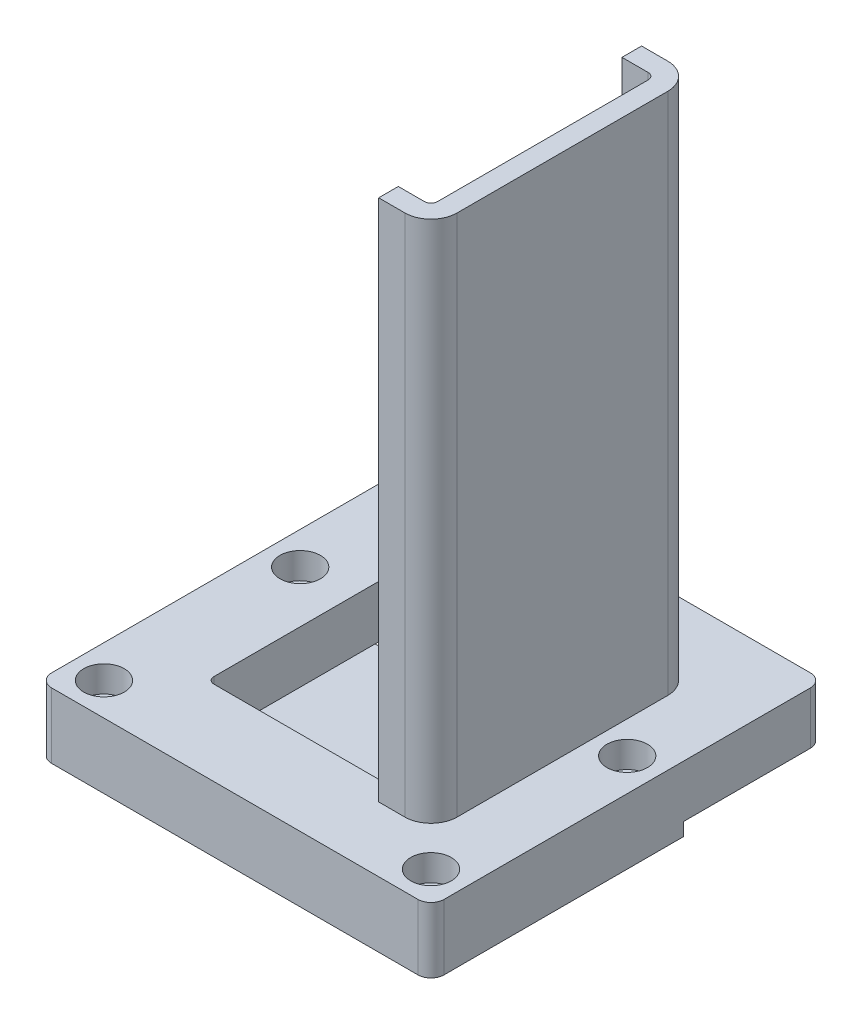
from build123d import *

# Parameters (mm, degrees)
SKETCH1_W           = 76.2
SKETCH1_H           = 76.2
BOSS_EXTRUDE1_DEPTH = 12.7
SKETCH2_W           = 43.434
SKETCH2_H           = 43.434
CUT_EXTRUDE1_DEPTH  = 10.16
FILLET1_R           = 1.27
CUT_EXTRUDE2_DEPTH  = 55.831064188
SKETCH4_R           = 2.54
CUT_EXTRUDE3_DEPTH  = 56.358016583
FILLET2_R           = 2.54
SKETCH5_W           = 76.2
SKETCH5_H           = 27.178
CUT_EXTRUDE4_DEPTH  = 2.54
BOSS_EXTRUDE2_DEPTH = 101.6
CUT_EXTRUDE6_DEPTH  = 1.27
SKETCH9_R           = 3.937
CUT_EXTRUDE7_DEPTH  = 5.08


with BuildPart() as part:
    # Sketch1 → Boss-Extrude1 (new body)
    with BuildSketch(Plane(origin=(0, 0, 0), x_dir=(1, 0, 0), z_dir=(0, 1, 0))):
        Rectangle(SKETCH1_W, SKETCH1_H)
    extrude(amount=BOSS_EXTRUDE1_DEPTH)

    # Sketch2 → Cut-Extrude1 (cut)
    with BuildSketch(Plane(origin=(0, 12.7, 0), x_dir=(1, 0, 0), z_dir=(0, 1, 0))):
        Rectangle(SKETCH2_W, SKETCH2_H)
    extrude(amount=-CUT_EXTRUDE1_DEPTH, mode=Mode.SUBTRACT)

    # Fillet1
    fillet1_edges = [part.edges().sort_by_distance(p)[0] for p in [
        (21.717, 7.62, -21.717),
        (21.717, 7.62, 21.717),
        (-21.717, 7.62, 21.717),
        (-21.717, 7.62, -21.717),
    ]]
    fillet(fillet1_edges, radius=FILLET1_R)

    # Sketch3 → Cut-Extrude2 (cut, through all)
    with BuildSketch(Plane(origin=(0, 2.54, 0), x_dir=(1, 0, 0), z_dir=(0, 1, 0))):
        with BuildLine():
            Line((-21.717, 10.8585), (21.717, 10.8585))
            Line((21.717, 10.8585), (21.717, 20.447))
            ThreePointArc((21.717, 20.447), (21.345025612, 21.345025612), (20.447, 21.717))
            Line((20.447, 21.717), (-20.447, 21.717))
            ThreePointArc((-20.447, 21.717), (-21.345025612, 21.345025612), (-21.717, 20.447))
            Line((-21.717, 20.447), (-21.717, 10.8585))
        make_face()
    extrude(amount=-CUT_EXTRUDE2_DEPTH, mode=Mode.SUBTRACT)

    # Sketch4 → Cut-Extrude3 (cut, through all)
    with BuildSketch(Plane(origin=(0, 12.7, 0), x_dir=(1, 0, 0), z_dir=(0, 1, 0))):
        with Locations(Location((31.75, -31.75, 0), (0, 0, 270))):
            Circle(SKETCH4_R)
        with Locations(Location((-31.75, -31.75, 0), (0, 0, 270))):
            Circle(SKETCH4_R)
        with Locations(Location((-31.75, 6.35, 0), (0, 0, 270))):
            Circle(SKETCH4_R)
        with Locations(Location((31.75, 6.35, 0), (0, 0, 270))):
            Circle(SKETCH4_R)
    extrude(amount=-CUT_EXTRUDE3_DEPTH, mode=Mode.SUBTRACT)

    # Fillet2
    fillet2_edges = [part.edges().sort_by_distance(p)[0] for p in [
        (38.1, 6.35, 38.1),
        (-38.1, 6.35, 38.1),
        (-38.1, 6.35, -38.1),
        (38.1, 6.35, -38.1),
    ]]
    fillet(fillet2_edges, radius=FILLET2_R)

    # Sketch5 → Cut-Extrude4 (cut)
    with BuildSketch(Plane.XZ):
        with Locations((0, -24.511)):
            Rectangle(SKETCH5_W, SKETCH5_H)
    extrude(amount=-CUT_EXTRUDE4_DEPTH, mode=Mode.SUBTRACT)

    # Sketch6 → Boss-Extrude2 (add)
    with BuildSketch(Plane(origin=(0, 12.7, 0), x_dir=(1, 0, 0), z_dir=(0, 1, 0))):
        with BuildLine():
            Line((21.717, 20.447), (21.717, -20.447))
            ThreePointArc((21.717, -20.447), (21.345025612, -21.345025612), (20.447, -21.717))
            Line((20.447, -21.717), (15.367, -21.717))
            Line((15.367, -21.717), (15.367, -25.527))
            Line((15.367, -25.527), (20.447, -25.527))
            ThreePointArc((20.447, -25.527), (24.039102448, -24.039102448), (25.527, -20.447))
            Line((25.527, -20.447), (25.527, 20.447))
            ThreePointArc((25.527, 20.447), (24.039102448, 24.039102448), (20.447, 25.527))
            Line((20.447, 25.527), (15.367, 25.527))
            Line((15.367, 25.527), (15.367, 21.717))
            Line((15.367, 21.717), (20.447, 21.717))
            ThreePointArc((20.447, 21.717), (21.345025612, 21.345025612), (21.717, 20.447))
        make_face()
    extrude(amount=BOSS_EXTRUDE2_DEPTH)

    # Sketch8 → Cut-Extrude6 (cut)
    # profile 1 of 6: a face of its own
    with BuildSketch(Plane.ZY.offset(38.1)):
        with BuildLine():
            Line((-4.12529872, 4.373330192), (-4.12529872, 9.664996859))
            Line((-4.12529872, 9.664996859), (-3.277275215, 9.664996859))
            add(Edge.make_bspline(
                [(-3.277275215, 9.664996859), (-3.217908268, 9.665003634), (-3.103034349, 9.665016744), (-2.937301264, 9.659196742), (-2.783597825, 9.651667918), (-2.642413174, 9.643244914), (-2.513507007, 9.628730396), (-2.397075345, 9.613433679), (-2.292885559, 9.594986781), (-2.228470675, 9.578439343), (-2.198165306, 9.570654244)],
                knots=[0, 0, 0, 0, 1.311965854, 2.538629056, 3.664479157, 4.713267157, 5.663616078, 6.530575999, 7.308677837, 8, 8, 8, 8], degree=3))
            add(Edge.make_bspline(
                [(-2.198165306, 9.570654244), (-2.15837128, 9.559673223), (-2.080282625, 9.538124936), (-1.968434751, 9.494607237), (-1.862331441, 9.446234231), (-1.762102244, 9.391049677), (-1.668362607, 9.328387344), (-1.581468773, 9.257749926), (-1.499546655, 9.181972804), (-1.425505123, 9.098944092), (-1.358583778, 9.011208877), (-1.300441127, 8.91879015), (-1.249922615, 8.823101051), (-1.209494573, 8.722937398), (-1.179032803, 8.618760472), (-1.156753192, 8.511015123), (-1.142312987, 8.39936042), (-1.140948577, 8.323398075), (-1.140255985, 8.284838605)],
                knots=[0, 0, 0, 0, 1.099996261, 2.158545794, 3.195537121, 4.207578794, 5.205712374, 6.197378256, 7.190519799, 8.17788031, 9.159561366, 10.129234751, 11.085776129, 12.040971148, 13.00380137, 13.975669004, 14.972423361, 16, 16, 16, 16], degree=3))
            add(Edge.make_bspline(
                [(-1.140255985, 8.284838605), (-1.142066907, 8.235299808), (-1.145631486, 8.137788771), (-1.16840226, 7.9945627), (-1.211101009, 7.859193477), (-1.266971283, 7.729186297), (-1.342937388, 7.605026089), (-1.439399649, 7.486771887), (-1.554795695, 7.370782467), (-1.643310831, 7.301254634), (-1.689351204, 7.265090342)],
                knots=[0, 0, 0, 0, 0.986156485, 1.941127874, 2.875419072, 3.804401753, 4.751181392, 5.761612777, 6.835722519, 8, 8, 8, 8], degree=3))
            add(Edge.make_bspline(
                [(-1.689351204, 7.265090342), (-1.652042295, 7.246044467), (-1.578889847, 7.208700777), (-1.475034861, 7.147318898), (-1.378876482, 7.082031484), (-1.289983562, 7.014152146), (-1.210220734, 6.940803378), (-1.136294457, 6.866211639), (-1.071851868, 6.786103131), (-1.014225363, 6.703333075), (-0.964137341, 6.61670295), (-0.920516198, 6.526359055), (-0.883670982, 6.431992756), (-0.852469501, 6.3340843), (-0.829199428, 6.232296929), (-0.814026845, 6.126594239), (-0.802409768, 6.01733673), (-0.801506069, 5.942913243), (-0.801046583, 5.905072647)],
                knots=[0, 0, 0, 0, 1.164658916, 2.283573913, 3.35186032, 4.395461096, 5.390182219, 6.362969632, 7.312859996, 8.245001507, 9.165155236, 10.092416118, 11.032087915, 11.979892451, 12.947605196, 13.931445124, 14.948243989, 16, 16, 16, 16], degree=3))
            add(Edge.make_bspline(
                [(-0.801046583, 5.905072647), (-0.804028338, 5.832799272), (-0.809912819, 5.690168056), (-0.852937276, 5.480752674), (-0.927528012, 5.282207897), (-1.02768799, 5.095322829), (-1.151104354, 4.925507484), (-1.292997781, 4.776750717), (-1.451939729, 4.650831415), (-1.598582887, 4.565845655), (-1.72541767, 4.508812263), (-1.830472551, 4.473550624), (-1.943299267, 4.440884294), (-2.065964531, 4.417945323), (-2.196244591, 4.396949054), (-2.335409684, 4.383985523), (-2.483199713, 4.375200457), (-2.584708294, 4.373966218), (-2.63701747, 4.373330192)],
                knots=[0, 0, 0, 0, 1.284142165, 2.534249414, 3.780121997, 5.041676246, 6.291546858, 7.49970053, 8.684500223, 9.883330709, 10.50184324, 11.153274765, 11.851151195, 12.587658647, 13.369265475, 14.195992086, 15.070362669, 16, 16, 16, 16], degree=3))
            Line((-2.63701747, 4.373330192), (-4.12529872, 4.373330192))
        make_face()
        with BuildLine():
            Line((-3.175512395, 8.715210534), (-3.175512395, 7.561898568))
            Line((-3.175512395, 7.561898568), (-2.923225402, 7.561898568))
            add(Edge.make_bspline(
                [(-2.923225402, 7.561898568), (-2.888937333, 7.562197573), (-2.822746291, 7.562774784), (-2.727140352, 7.57020906), (-2.638242268, 7.582892398), (-2.556389211, 7.600588844), (-2.48081869, 7.62306075), (-2.412013471, 7.650099293), (-2.350276079, 7.683089254), (-2.278551507, 7.732229257), (-2.202733463, 7.804540972), (-2.135991692, 7.909010226), (-2.096681234, 8.029149471), (-2.092303109, 8.113880969), (-2.090042309, 8.15763508)],
                knots=[0, 0, 0, 0, 1.065314748, 2.056525647, 2.977365736, 3.853934255, 4.656397591, 5.425096493, 6.14721249, 6.826394842, 8.123232004, 9.372140726, 10.643011755, 12, 12, 12, 12], degree=3))
            add(Edge.make_bspline(
                [(-2.090042309, 8.15763508), (-2.091851363, 8.198618075), (-2.095349096, 8.277857048), (-2.134929673, 8.389115623), (-2.196406133, 8.487713492), (-2.268987736, 8.555195669), (-2.337337418, 8.601284007), (-2.395862611, 8.631631215), (-2.460098405, 8.658797725), (-2.531288335, 8.679569901), (-2.609025869, 8.69515661), (-2.692933393, 8.706603182), (-2.783155674, 8.714394205), (-2.845472396, 8.714932588), (-2.877644139, 8.715210534)],
                knots=[0, 0, 0, 0, 1.347982417, 2.606269829, 3.849316587, 5.153353503, 5.842674298, 6.568177932, 7.326619318, 8.142485038, 9.012069166, 9.942760135, 10.937925643, 12, 12, 12, 12], degree=3))
            Line((-2.877644139, 8.715210534), (-3.175512395, 8.715210534))
        make_face(mode=Mode.SUBTRACT)
        with BuildLine():
            Line((-3.175512395, 6.679954124), (-3.175512395, 5.323116517))
            Line((-3.175512395, 5.323116517), (-2.902024815, 5.323116517))
            add(Edge.make_bspline(
                [(-2.902024815, 5.323116517), (-2.847955972, 5.32342541), (-2.744001875, 5.324019296), (-2.595087815, 5.33119485), (-2.459687705, 5.344127521), (-2.338160306, 5.36027292), (-2.230319475, 5.38214741), (-2.13652974, 5.409958021), (-2.055504896, 5.440554536), (-1.987730771, 5.478344866), (-1.932363195, 5.522323438), (-1.882399762, 5.567270595), (-1.841662692, 5.619121387), (-1.809430762, 5.675650004), (-1.781534083, 5.735452233), (-1.764708777, 5.80086333), (-1.751898579, 5.869944668), (-1.751193599, 5.917726735), (-1.750832908, 5.942173675)],
                knots=[0, 0, 0, 0, 1.753078804, 3.370512758, 4.83203934, 6.162291463, 7.344201807, 8.395507345, 9.331626367, 10.147333109, 10.898971645, 11.62040215, 12.321813352, 13.025280112, 13.727906689, 14.453419512, 15.208716525, 16, 16, 16, 16], degree=3))
            add(Edge.make_bspline(
                [(-1.750832908, 5.942173675), (-1.751628336, 5.970129135), (-1.753177617, 6.024578851), (-1.765830612, 6.104162922), (-1.788825237, 6.178459933), (-1.817788089, 6.249369758), (-1.858091437, 6.314353579), (-1.905990588, 6.37566024), (-1.963864991, 6.431213707), (-2.028948133, 6.484374062), (-2.104861174, 6.530918833), (-2.191639732, 6.571304666), (-2.289755233, 6.605033426), (-2.399511602, 6.631888288), (-2.520427675, 6.654679637), (-2.653386006, 6.668288589), (-2.797279272, 6.678410164), (-2.897057205, 6.679427776), (-2.948666107, 6.679954124)],
                knots=[0, 0, 0, 0, 0.845221588, 1.646264278, 2.427170338, 3.19324141, 3.95557735, 4.731569926, 5.540061037, 6.376114724, 7.268642756, 8.224665384, 9.265483498, 10.400594375, 11.639216012, 12.983232105, 14.439614077, 16, 16, 16, 16], degree=3))
            Line((-2.948666107, 6.679954124), (-3.175512395, 6.679954124))
        make_face(mode=Mode.SUBTRACT)
    # profile 2 of 6: a face of its own
    with BuildSketch(Plane.ZY.offset(38.1)):
        with BuildLine():
            Line((2.624968374, 9.664996859), (3.574754699, 9.664996859))
            Line((3.574754699, 9.664996859), (3.574754699, 6.222021431))
            add(Edge.make_bspline(
                [(3.574754699, 6.222021431), (3.574806344, 6.186326155), (3.574906095, 6.117381099), (3.579899692, 6.018467515), (3.584469178, 5.927545222), (3.592713826, 5.844713759), (3.604893999, 5.769937694), (3.61668838, 5.702736692), (3.632650908, 5.644313912), (3.656640037, 5.577813492), (3.693599409, 5.503096638), (3.753988972, 5.425225019), (3.823673362, 5.354155864), (3.907194117, 5.295000592), (4.001064059, 5.247149309), (4.104767415, 5.211696803), (4.218158, 5.191989918), (4.296561369, 5.188981301), (4.336915824, 5.187432756)],
                knots=[0, 0, 0, 0, 1.155499968, 2.231836252, 3.205919964, 4.102923608, 4.924856345, 5.658536265, 6.31071849, 6.882491295, 7.94666036, 8.992281882, 10.060072772, 11.158554251, 12.289267114, 13.461410017, 14.693379945, 16, 16, 16, 16], degree=3))
            add(Edge.make_bspline(
                [(4.336915824, 5.187432756), (4.379787452, 5.188683781), (4.463379869, 5.191123068), (4.583614253, 5.215067313), (4.695012091, 5.25319475), (4.795214712, 5.30761232), (4.884122398, 5.372841315), (4.959380891, 5.447222809), (5.018774617, 5.530905158), (5.057485238, 5.608108497), (5.079219345, 5.679167447), (5.095510142, 5.742655923), (5.107453097, 5.81756604), (5.118288139, 5.902727915), (5.124799165, 5.999023662), (5.131859311, 6.105678857), (5.13444692, 6.223423263), (5.134887959, 6.305410903), (5.135117947, 6.348164928)],
                knots=[0, 0, 0, 0, 1.261321664, 2.459363699, 3.594844139, 4.716940403, 5.803436589, 6.833651888, 7.818396249, 8.814403945, 9.360733334, 10.004355033, 10.743453831, 11.592799886, 12.532235708, 13.585170094, 14.740740724, 16, 16, 16, 16], degree=3))
            Line((5.135117947, 6.348164928), (5.135117947, 9.664996859))
            Line((5.135117947, 9.664996859), (6.084904272, 9.664996859))
            Line((6.084904272, 9.664996859), (6.084904272, 6.508229364))
            add(Edge.make_bspline(
                [(6.084904272, 6.508229364), (6.084772377, 6.444273405), (6.084518755, 6.321292335), (6.080623895, 6.144559881), (6.072332443, 5.983143134), (6.065368579, 5.836994928), (6.051891117, 5.706312148), (6.037850764, 5.590536743), (6.019955126, 5.490078993), (5.993327493, 5.375720052), (5.947376081, 5.244039921), (5.87329638, 5.092415958), (5.779256995, 4.943966913), (5.668107141, 4.80032583), (5.54260879, 4.666887892), (5.405544506, 4.549746655), (5.259091903, 4.4506578), (5.101720654, 4.37204417), (4.933564691, 4.310731464), (4.752960236, 4.269532414), (4.560030447, 4.241697819), (4.426770195, 4.239023964), (4.358116411, 4.237646431)],
                knots=[0, 0, 0, 0, 1.170808336, 2.251350247, 3.235597562, 4.129743112, 4.929140599, 5.639994148, 6.264258765, 6.79612947, 7.788252245, 8.809469599, 9.879094798, 10.999557536, 12.129761673, 13.226370002, 14.293821979, 15.358369427, 16.438775801, 17.562147481, 18.744053101, 20, 20, 20, 20], degree=3))
            add(Edge.make_bspline(
                [(4.358116411, 4.237646431), (4.312501471, 4.238414755), (4.222504131, 4.239930641), (4.090147253, 4.253296799), (3.962198331, 4.27299349), (3.83889778, 4.301728933), (3.719817646, 4.338849759), (3.604989566, 4.384542911), (3.494840269, 4.438553518), (3.389986135, 4.500384799), (3.290556197, 4.567244685), (3.199682365, 4.641361684), (3.114237459, 4.717254562), (3.036689946, 4.798117216), (2.966457376, 4.883100724), (2.903684391, 4.972397688), (2.848464252, 5.066000175), (2.799407927, 5.165595365), (2.757420501, 5.276245322), (2.722023523, 5.40188591), (2.691099891, 5.54448642), (2.668119272, 5.704368124), (2.647284907, 5.881004069), (2.634097903, 6.074854419), (2.627199188, 6.285924736), (2.625730769, 6.43225541), (2.624968374, 6.508229364)],
                knots=[0, 0, 0, 0, 1.001158378, 1.975264943, 2.917723546, 3.841610987, 4.75185031, 5.653588123, 6.552117133, 7.442167995, 8.324307438, 9.179605724, 10.014504199, 10.831958861, 11.636465792, 12.43274043, 13.225645099, 14.020104002, 14.867201867, 15.819789774, 16.883317127, 18.068162734, 19.364263498, 20.787406516, 22.332041935, 24, 24, 24, 24], degree=3))
            Line((2.624968374, 6.508229364), (2.624968374, 9.664996859))
        make_face()
    # profile 3 of 6: a face of its own
    with BuildSketch(Plane.ZY.offset(38.1)):
        Polygon((9.239551708, 9.664996859), (12.088910682, 9.664996859), (12.088910682, 8.715210534), (11.139124357, 8.715210534), (11.139124357, 4.373330192), (10.189338033, 4.373330192), (10.189338033, 8.715210534), (9.239551708, 8.715210534), align=None)
    # profile 4 of 6: a face of its own
    with BuildSketch(Plane.ZY.offset(38.1)):
        Polygon((14.768664956, 9.664996859), (17.61802393, 9.664996859), (17.61802393, 8.715210534), (16.668237605, 8.715210534), (16.668237605, 4.373330192), (15.71845128, 4.373330192), (15.71845128, 8.715210534), (14.768664956, 8.715210534), align=None)
    # profile 5 of 6: a face of its own
    with BuildSketch(Plane.ZY.offset(38.1)):
        Polygon((20.840513246, 9.664996859), (23.689872221, 9.664996859), (23.689872221, 8.715210534), (21.790299571, 8.715210534), (21.790299571, 7.697582329), (23.689872221, 7.697582329), (23.689872221, 6.747796004), (21.790299571, 6.747796004), (21.790299571, 5.323116517), (23.689872221, 5.323116517), (23.689872221, 4.373330192), (20.840513246, 4.373330192), align=None)
    # profile 6 of 6: a face of its own
    with BuildSketch(Plane.ZY.offset(38.1)):
        with BuildLine():
            Line((27.115887178, 9.664996859), (28.222557851, 9.664996859))
            add(Edge.make_bspline(
                [(28.222557851, 9.664996859), (28.295708446, 9.664737216), (28.436397644, 9.66423785), (28.639263785, 9.656359179), (28.825624234, 9.645395361), (28.995754914, 9.628664284), (29.149583041, 9.606480898), (29.287262787, 9.580330357), (29.408790128, 9.550526209), (29.515189978, 9.51338789), (29.611210582, 9.471496428), (29.700715134, 9.423362371), (29.785678238, 9.369521705), (29.865532007, 9.308557738), (29.940970389, 9.241567196), (30.012135704, 9.168482647), (30.07802232, 9.088684363), (30.138222263, 9.002676569), (30.193089665, 8.912198342), (30.241580942, 8.817125454), (30.281014128, 8.71739179), (30.315857575, 8.614438715), (30.340954181, 8.506794496), (30.358408504, 8.395507068), (30.371187876, 8.280184686), (30.371922629, 8.20183978), (30.372297434, 8.161875197)],
                knots=[0, 0, 0, 0, 1.749336639, 3.364467119, 4.854658419, 6.213483162, 7.451590619, 8.570285859, 9.5643256, 10.440900261, 11.26203566, 12.067320669, 12.869050712, 13.665104639, 14.467235401, 15.27997916, 16.102287765, 16.939272006, 17.78853747, 18.631303466, 19.488103222, 20.351255419, 21.228522269, 22.127379805, 23.044756219, 24, 24, 24, 24], degree=3))
            add(Edge.make_bspline(
                [(30.372297434, 8.161875197), (30.371323825, 8.120161354), (30.369414754, 8.03836811), (30.35913146, 7.918220505), (30.34033683, 7.803271681), (30.311869628, 7.693858194), (30.279150277, 7.588618264), (30.235641933, 7.489493635), (30.186538466, 7.395042683), (30.128219713, 7.306601452), (30.064217732, 7.222205485), (29.989784773, 7.145088305), (29.90974295, 7.071105156), (29.81959282, 7.004890091), (29.723308286, 6.941965887), (29.618976273, 6.884939801), (29.507277689, 6.832378328), (29.428748053, 6.80306642), (29.388590169, 6.78807712)],
                knots=[0, 0, 0, 0, 1.099860209, 2.156625411, 3.176576793, 4.16617041, 5.135385252, 6.078461593, 7.016046972, 7.938469504, 8.868247731, 9.803980173, 10.76021508, 11.73834243, 12.748633912, 13.790971185, 14.870363756, 16, 16, 16, 16], degree=3))
            Line((29.388590169, 6.78807712), (30.609744015, 4.373330192))
            Line((30.609744015, 4.373330192), (29.553954753, 4.373330192))
            Line((29.553954753, 4.373330192), (28.387922434, 6.679954124))
            Line((28.387922434, 6.679954124), (28.065673503, 6.679954124))
            Line((28.065673503, 6.679954124), (28.065673503, 4.373330192))
            Line((28.065673503, 4.373330192), (27.115887178, 4.373330192))
            Line((27.115887178, 4.373330192), (27.115887178, 9.664996859))
        make_face()
        with BuildLine():
            Line((28.065673503, 7.629740448), (28.435623756, 7.629740448))
            add(Edge.make_bspline(
                [(28.435623756, 7.629740448), (28.48085325, 7.630249853), (28.567458012, 7.631225254), (28.692007034, 7.635749569), (28.80512725, 7.646650931), (28.907304435, 7.660424394), (28.999052737, 7.676327846), (29.079553792, 7.699118459), (29.150047998, 7.723539178), (29.209699998, 7.753887797), (29.260665296, 7.788400758), (29.304670569, 7.827608341), (29.341069239, 7.872986125), (29.371027201, 7.923300938), (29.394331238, 7.978997804), (29.4113414, 8.039465295), (29.420847565, 8.105392215), (29.421941282, 8.150890766), (29.422511109, 8.17459555)],
                knots=[0, 0, 0, 0, 1.688639943, 3.233382647, 4.650958383, 5.928841754, 7.082724185, 8.122798841, 9.049171256, 9.863274652, 10.613301712, 11.341792392, 12.054588806, 12.776240173, 13.521029143, 14.301969904, 15.115324896, 16, 16, 16, 16], degree=3))
            add(Edge.make_bspline(
                [(29.422511109, 8.17459555), (29.421433799, 8.202640039), (29.419317621, 8.257728242), (29.398318568, 8.337035937), (29.364892612, 8.410440636), (29.319074781, 8.477610676), (29.261373179, 8.53649657), (29.195156038, 8.588404955), (29.118994233, 8.629450222), (29.048474133, 8.656523243), (28.984317326, 8.67272131), (28.926417831, 8.684791967), (28.859369867, 8.693346788), (28.783122817, 8.702420698), (28.697871037, 8.70830467), (28.603149854, 8.712598796), (28.499231306, 8.714355735), (28.426790209, 8.714917397), (28.388982464, 8.715210534)],
                knots=[0, 0, 0, 0, 1.020303359, 2.004196876, 2.966617323, 3.9489082, 4.950758222, 5.960522915, 7.003732012, 8.091992268, 8.70421221, 9.413913587, 10.24622431, 11.166358409, 12.212345909, 13.359657661, 14.621978493, 16, 16, 16, 16], degree=3))
            Line((28.388982464, 8.715210534), (28.065673503, 8.715210534))
            Line((28.065673503, 8.715210534), (28.065673503, 7.629740448))
        make_face(mode=Mode.SUBTRACT)
    extrude(amount=-CUT_EXTRUDE6_DEPTH, mode=Mode.SUBTRACT)

    # Sketch9 → Cut-Extrude7 (cut)
    with BuildSketch(Plane(origin=(0, 12.7, 0), x_dir=(1, 0, 0), z_dir=(0, 1, 0))):
        with Locations(Location((-31.75, 6.35, 0), (0, 0, 270))):
            Circle(SKETCH9_R)
        with Locations(Location((-31.75, -31.75, 0), (0, 0, 270))):
            Circle(SKETCH9_R)
        with Locations(Location((31.75, -31.75, 0), (0, 0, 270))):
            Circle(SKETCH9_R)
        with Locations(Location((31.75, 6.35, 0), (0, 0, 270))):
            Circle(SKETCH9_R)
    extrude(amount=-CUT_EXTRUDE7_DEPTH, mode=Mode.SUBTRACT)


solid = part.part
